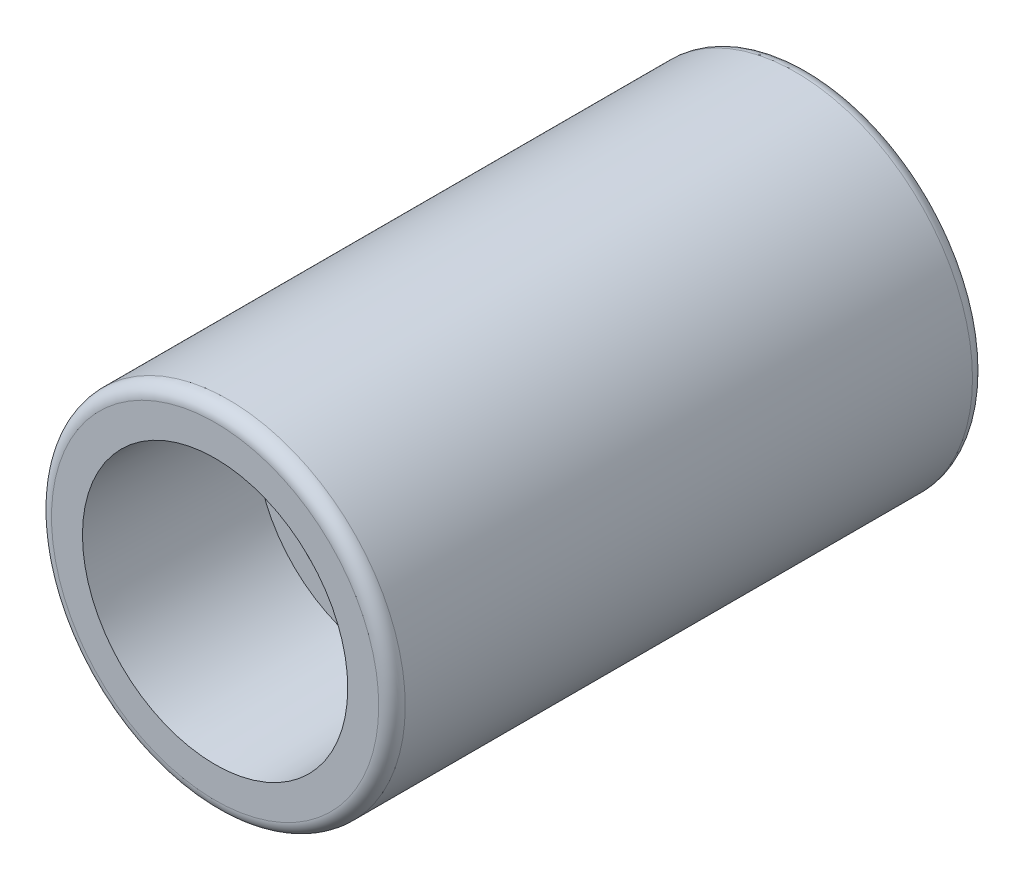
from build123d import *

# Parameters (mm, degrees)
BODYSCH_R  = 14.224
BODY_DEPTH = 23.876
FLOWSCH_R  = 8.5344
FLOW_DEPTH = 47.752
FILLET1_R  = 1.0668


with BuildPart() as part:
    # BodySch → Body (new, symmetric)
    with BuildSketch(Plane.XY):
        Circle(BODYSCH_R)
    extrude(amount=BODY_DEPTH, both=True)

    # FlowSch → Flow (cut)
    with BuildSketch(Plane.XY.offset(-23.876)):
        Circle(FLOWSCH_R)
    extrude(amount=FLOW_DEPTH, mode=Mode.SUBTRACT)

    # ThreadSch → Thread (revolve, cut)
    with BuildSketch(Plane(origin=(0, 0, 0), x_dir=(0, 0, -1), z_dir=(1, 0, 0)), mode=Mode.PRIVATE) as thread_sk:
        Polygon((-10.32002, 0), (-10.32002, 10.245933299), (-23.876, 10.668), (-23.876, 0), align=None)
    thread = revolve(thread_sk.sketch.rotate(Axis((0, 0, 0), (0, 0, 1)), 90), axis=Axis((0, 0, 0), (0, 0, 1)), mode=Mode.SUBTRACT)

    # Fillet1
    fillet1_edges = [part.edges().sort_by_distance(p)[0] for p in [
        (-14.224, 0, -23.876),
        (-14.224, 0, 23.876),
    ]]
    fillet(fillet1_edges, radius=FILLET1_R)

    # Mirror1: Thread across plane
    add(thread.mirror(Plane.XY), mode=Mode.SUBTRACT)


solid = part.part
